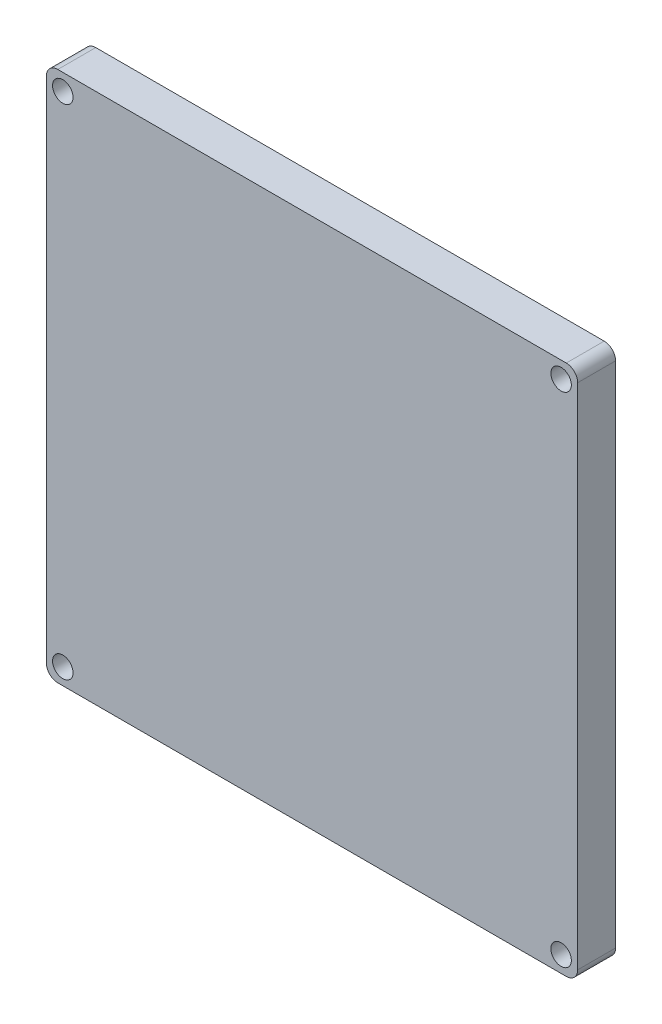
from build123d import *

# Parameters (mm, degrees)
SKETCH1_W           = 70
SKETCH1_H           = 70
SKETCH1_R           = 1.35
BOSS_EXTRUDE1_DEPTH = 5
FILLET1_R           = 1.5
SKETCH2_W           = 24.359680225
SKETCH2_H           = 19.606300568
BOSS_EXTRUDE2_DEPTH = 9


with BuildPart() as part:
    # Sketch1 → Boss-Extrude1 (new body)
    with BuildSketch(Plane.XY):
        Rectangle(SKETCH1_W, SKETCH1_H)
        with Locations((-32.84, 32.82)):
            Circle(SKETCH1_R, mode=Mode.SUBTRACT)
        with Locations((-32.84, -32.84)):
            Circle(SKETCH1_R, mode=Mode.SUBTRACT)
        with Locations((32.82, -32.84)):
            Circle(SKETCH1_R, mode=Mode.SUBTRACT)
        with Locations((32.82, 32.82)):
            Circle(SKETCH1_R, mode=Mode.SUBTRACT)
    extrude(amount=BOSS_EXTRUDE1_DEPTH)

    # Fillet1
    fillet1_edges = [part.edges().sort_by_distance(p)[0] for p in [
        (35, -35, 2.5),
        (-35, -35, 2.5),
        (-35, 35, 2.5),
        (35, 35, 2.5),
    ]]
    fillet(fillet1_edges, radius=FILLET1_R)

    # Sketch2 → Boss-Extrude2 (add)
    with BuildSketch(Plane(origin=(0, 0, 0), x_dir=(-1, 0, 0), z_dir=(0, 0, -1))):
        with Locations((1.199225338, -25.196849716)):
            Rectangle(SKETCH2_W, SKETCH2_H)
    extrude(amount=BOSS_EXTRUDE2_DEPTH)


solid = part.part
